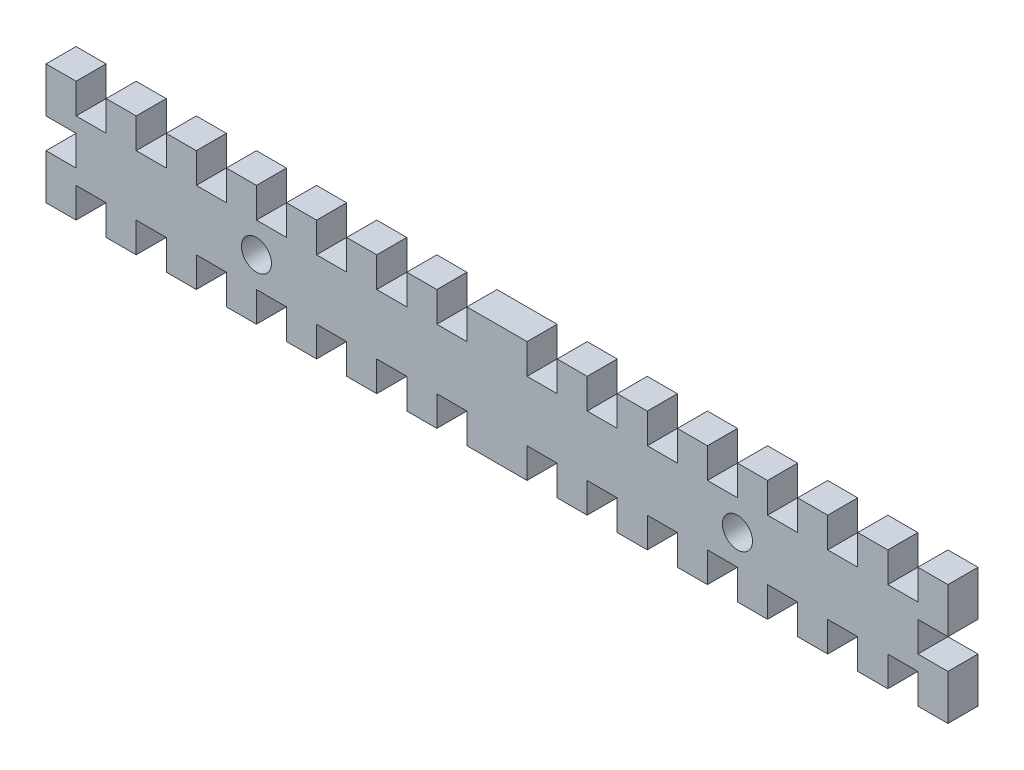
from build123d import *

# Parameters (mm, degrees)
SKETCH1_R           = 3.175
BOSS_EXTRUDE1_DEPTH = 6.35


with BuildPart() as part:
    # Sketch1 → Boss-Extrude1 (new body)
    with BuildSketch(Plane.XY):
        Polygon((-88.9, 12.7), (-95.25, 12.7), (-95.25, 3.175), (-88.9, 3.175), (-88.9, -3.175), (-95.25, -3.175), (-95.25, -12.7), (-88.9, -12.7), (-88.9, -6.35), (-82.55, -6.35), (-82.55, -12.7), (-76.2, -12.7), (-76.2, -6.35), (-69.85, -6.35), (-69.85, -12.7), (-63.5, -12.7), (-63.5, -6.35), (-57.15, -6.35), (-57.15, -12.7), (-50.8, -12.7), (-50.8, -6.35), (-44.45, -6.35), (-44.45, -12.7), (-38.1, -12.7), (-38.1, -6.35), (-31.75, -6.35), (-31.75, -12.7), (-25.4, -12.7), (-25.4, -6.35), (-19.05, -6.35), (-19.05, -12.7), (-12.7, -12.7), (-12.7, -6.35), (-6.35, -6.35), (-6.35, -12.7), (6.35, -12.7), (6.35, -6.35), (12.7, -6.35), (12.7, -12.7), (19.05, -12.7), (19.05, -6.35), (25.4, -6.35), (25.4, -12.7), (31.75, -12.7), (31.75, -6.35), (38.1, -6.35), (38.1, -12.7), (44.45, -12.7), (44.45, -6.35), (50.8, -6.35), (50.8, -12.7), (57.15, -12.7), (57.15, -6.35), (63.5, -6.35), (63.5, -12.7), (69.85, -12.7), (69.85, -6.35), (76.2, -6.35), (76.2, -12.7), (82.55, -12.7), (82.55, -6.35), (88.9, -6.35), (88.9, -12.7), (95.25, -12.7), (95.25, -3.175), (88.9, -3.175), (88.9, 3.175), (95.25, 3.175), (95.25, 12.7), (88.9, 12.7), (88.9, 6.35), (82.55, 6.35), (82.55, 12.7), (76.2, 12.7), (76.2, 6.35), (69.85, 6.35), (69.85, 12.7), (63.5, 12.7), (63.5, 6.35), (57.15, 6.35), (57.15, 12.7), (50.8, 12.7), (50.8, 6.35), (44.45, 6.35), (44.45, 12.7), (38.1, 12.7), (38.1, 6.35), (31.75, 6.35), (31.75, 12.7), (25.4, 12.7), (25.4, 6.35), (19.05, 6.35), (19.05, 12.7), (12.7, 12.7), (12.7, 6.35), (6.35, 6.35), (6.35, 12.7), (-6.35, 12.7), (-6.35, 6.35), (-12.7, 6.35), (-12.7, 12.7), (-19.05, 12.7), (-19.05, 6.35), (-25.4, 6.35), (-25.4, 12.7), (-31.75, 12.7), (-31.75, 6.35), (-38.1, 6.35), (-38.1, 12.7), (-44.45, 12.7), (-44.45, 6.35), (-50.8, 6.35), (-50.8, 12.7), (-57.15, 12.7), (-57.15, 6.35), (-63.5, 6.35), (-63.5, 12.7), (-69.85, 12.7), (-69.85, 6.35), (-76.2, 6.35), (-76.2, 12.7), (-82.55, 12.7), (-82.55, 6.35), (-88.9, 6.35), align=None)
        with Locations((-50.8, 0)):
            Circle(SKETCH1_R, mode=Mode.SUBTRACT)
        with Locations((50.8, 0)):
            Circle(SKETCH1_R, mode=Mode.SUBTRACT)
    extrude(amount=BOSS_EXTRUDE1_DEPTH)


solid = part.part
